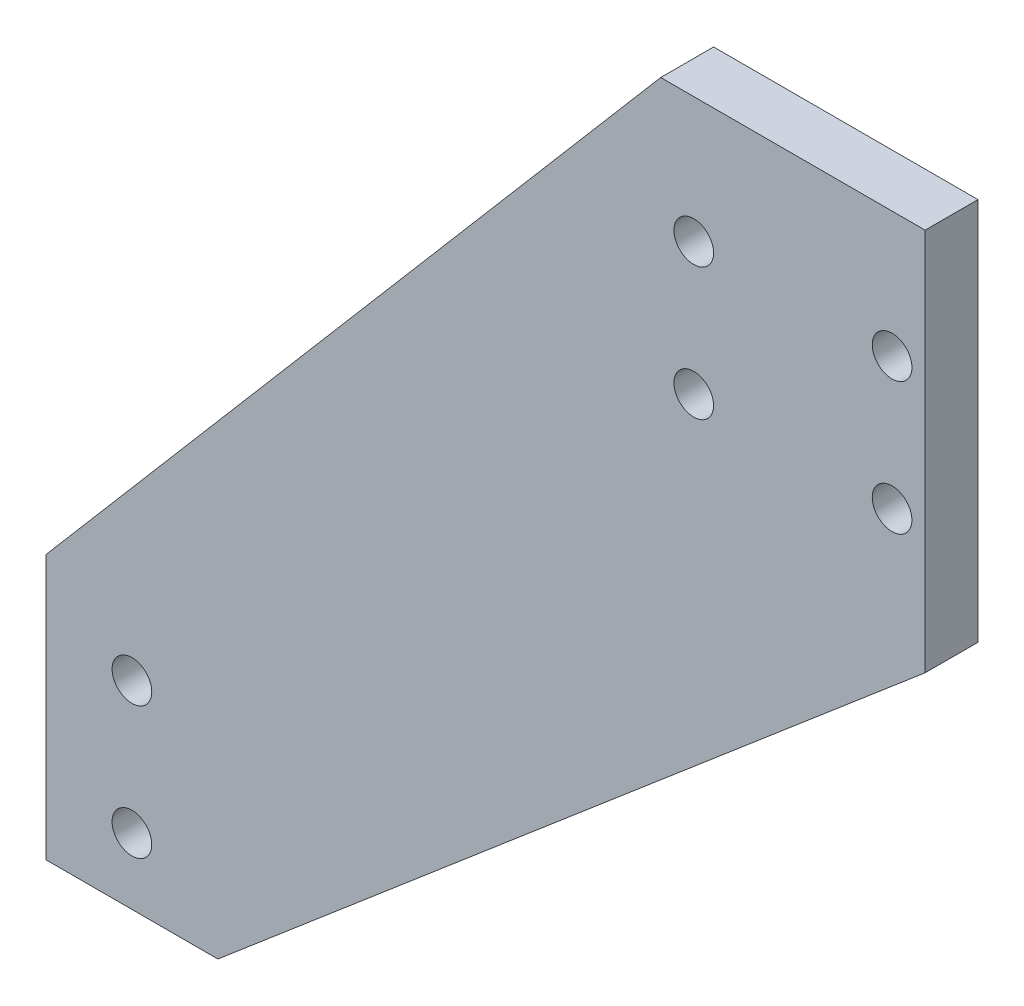
from build123d import *

# Parameters (mm, degrees)
SKETCH_1_R      = 1.5
EXTRUDE_1_DEPTH = 4


with BuildPart() as part:
    # 草图1 → 凸台-拉伸1 (new body)
    with BuildSketch(Plane.XY):
        Polygon((0, 0), (13, 0), (66.5, 45.5), (66.5, 74.5), (46.5, 74.5), (0, 20), align=None)
        with Locations((6.5, 15)):
            Circle(SKETCH_1_R, mode=Mode.SUBTRACT)
        with Locations(Location((6.5, 5, 0), (0, 0, 180))):
            Circle(SKETCH_1_R, mode=Mode.SUBTRACT)
        with Locations((49, 55)):
            Circle(SKETCH_1_R, mode=Mode.SUBTRACT)
        with Locations(Location((64, 55, 0), (0, 0, 180))):
            Circle(SKETCH_1_R, mode=Mode.SUBTRACT)
        with Locations(Location((49, 65, 0), (0, 0, 180))):
            Circle(SKETCH_1_R, mode=Mode.SUBTRACT)
        with Locations((64, 65)):
            Circle(SKETCH_1_R, mode=Mode.SUBTRACT)
    extrude(amount=EXTRUDE_1_DEPTH)


solid = part.part
